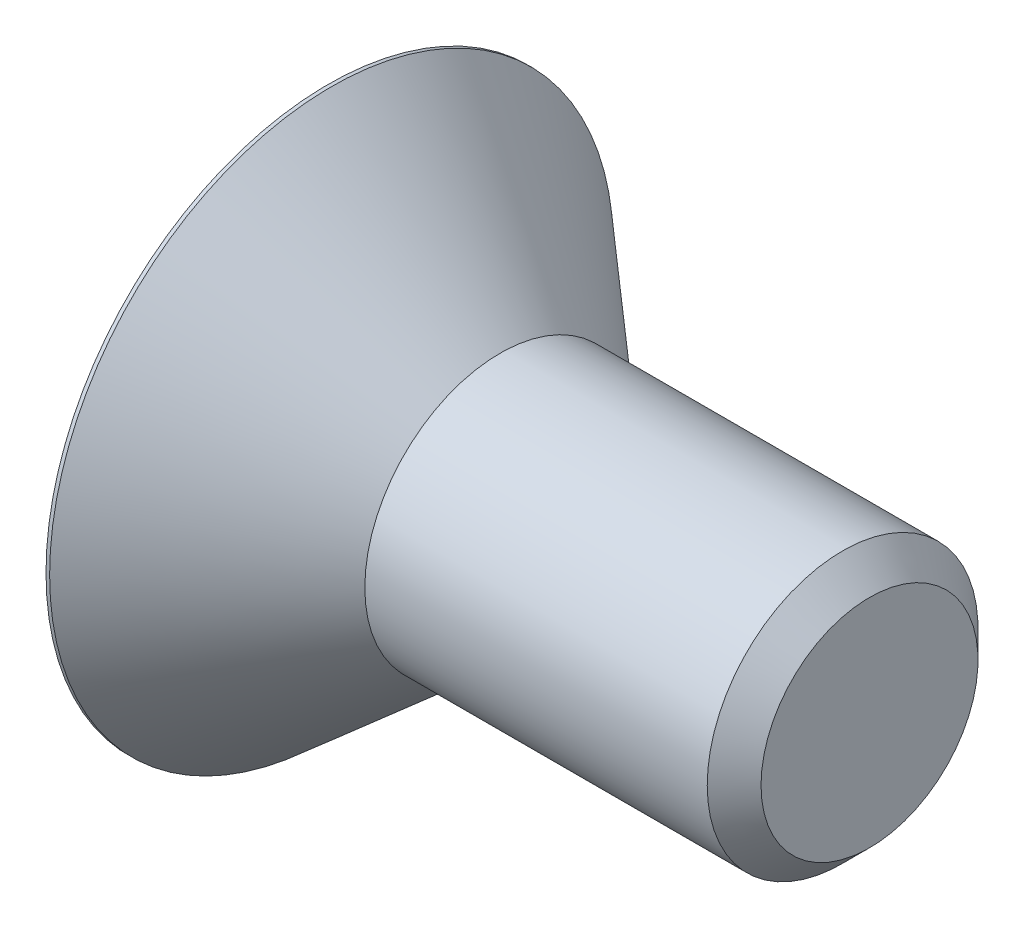
from build123d import *

# Parameters (mm, degrees)
HEX_2_DEPTH = 4.0386


with BuildPart() as part:
    # BodySke → BaseBody (revolve)
    with BuildSketch(Plane.XY, mode=Mode.PRIVATE) as basebody_sk:
        Polygon((0, 0), (0, 9.9187), (0.127, 9.9187), (6.058529581, 4.7625), (18.10385, 4.7625), (19.05, 3.81635), (19.05, 0), align=None)
    revolve(basebody_sk.sketch.rotate(Axis((0, 0, 0), (1, 0, 0)), 90), axis=Axis((0, 0, 0), (1, 0, 0)))

    # Sketch2 → PreBroach (revolve, cut)
    with BuildSketch(Plane.XY, mode=Mode.PRIVATE) as prebroach_sk:
        Polygon((0, 2.77876), (4.0386, 2.77876), (5.642917834, 0), (0, 0), align=None)
    revolve(prebroach_sk.sketch.rotate(Axis((0, 0, 0), (1, 0, 0)), 90), axis=Axis((0, 0, 0), (1, 0, 0)), mode=Mode.SUBTRACT)

    # Sketch3 → Hex 2 (cut)
    with BuildSketch(Plane.ZY):
        Polygon((-2.77876, -1.604317834), (-2.77876, 1.604317834), (0, 3.208635668), (2.77876, 1.604317834), (2.77876, -1.604317834), (0, -3.208635668), align=None)
    extrude(amount=-HEX_2_DEPTH, mode=Mode.SUBTRACT)


solid = part.part
